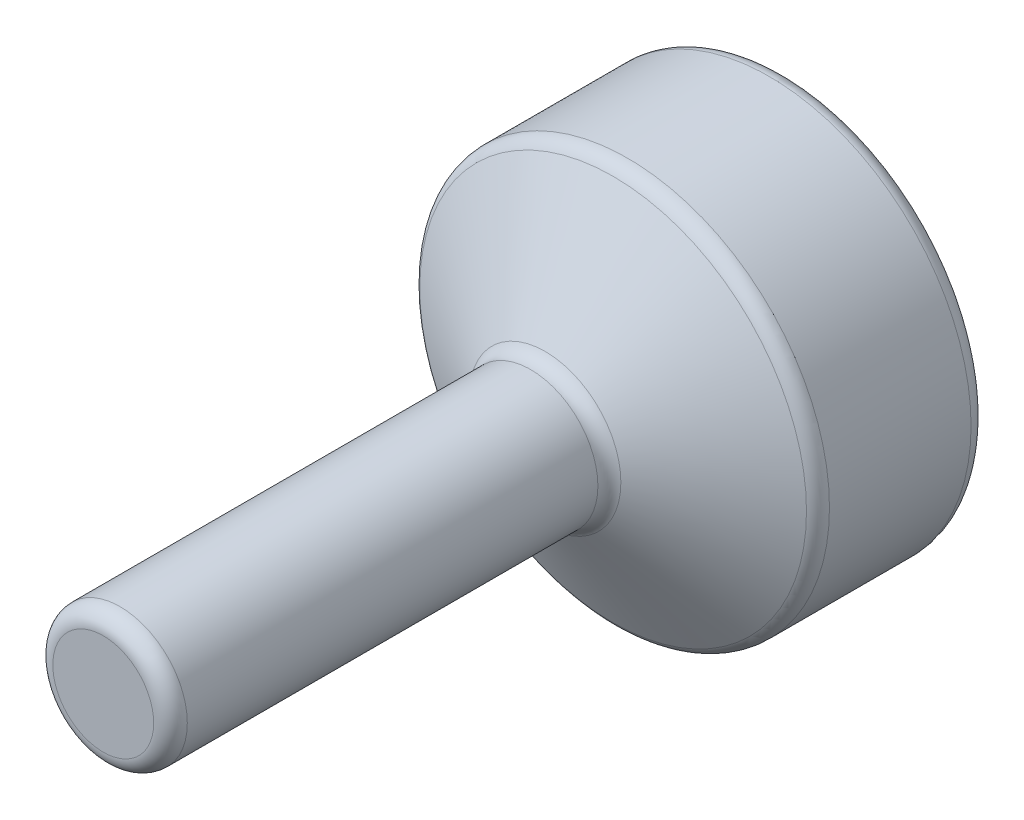
from build123d import *

# Parameters (mm, degrees)
FILLET1_R = 0.254


with BuildPart() as part:
    # Sketch1 → Revolve1 (revolve)
    with BuildSketch(Plane(origin=(0, 0, 0), x_dir=(1, 0, 0), z_dir=(0, 1, 0))):
        Polygon((0, 0), (3.048, 0), (3.048, -2.54), (1.016, -3.713175747), (1.016, -10.317175747), (0, -10.317175747), align=None)
    revolve(axis=Axis((0, 0, 10.317175747), (0, 0, -1)))

    # Fillet1
    fillet1_edges = [part.edges().sort_by_distance(p)[0] for p in [
        (-1.016, 0, 10.317175747),
        (-1.016, 0, 3.713175747),
        (-3.048, 0, 2.54),
        (-3.048, 0, 0),
    ]]
    fillet(fillet1_edges, radius=FILLET1_R)


solid = part.part
